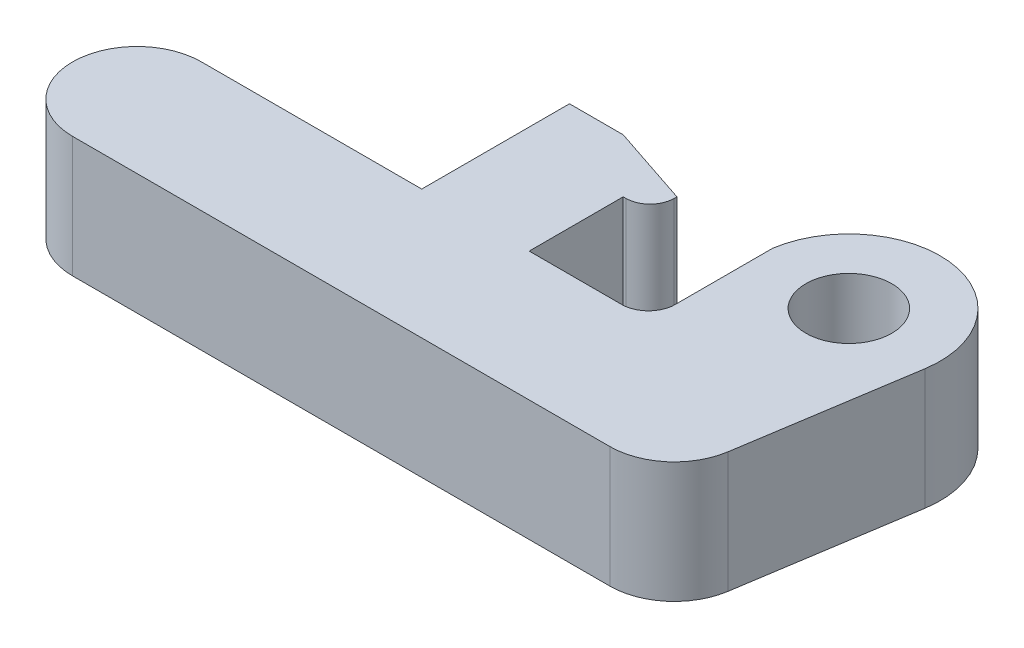
from build123d import *

# Parameters (mm, degrees)
SKETCH1_R           = 1.6
BOSS_EXTRUDE1_DEPTH = 4.5
CUT_EXTRUDE1_DEPTH  = 10
FILLET1_R           = 1


with BuildPart() as part:
    # Sketch1 → Boss-Extrude1 (new body)
    with BuildSketch(Plane(origin=(0, 0, 0), x_dir=(1, 0, 0), z_dir=(0, 1, 0))):
        with BuildLine():
            Line((3.359522367, -0.523076923), (2.371427553, -6.869230769))
            ThreePointArc((2.371427553, -6.869230769), (1.561064725, -8.322930861), (0, -8.9))
            Line((0, -8.9), (-20, -8.9))
            ThreePointArc((-20, -8.9), (-22.4, -6.5), (-20, -4.1))
            Line((-20, -4.1), (-11.8, -4.1))
            Line((-11.8, -4.1), (-11.8, 1.4))
            Line((-11.8, 1.4), (-9.8, 1.4))
            Line((-9.8, 1.4), (-6.8, 0.4))
            Line((-6.8, 0.4), (-6.8, 0.3))
            ThreePointArc((-6.8, 0.3), (-7.063603897, -0.336396103), (-7.7, -0.6))
            Line((-7.7, -0.6), (-7.8, -0.6))
            Line((-7.8, -0.6), (-7.8, -4.1))
            Line((-7.8, -4.1), (-4.079334467, -4.1))
            Line((-4.079334467, -4.1), (-3.359522367, 0.523076923))
            ThreePointArc((-3.359522367, 0.523076923), (0.523076923, 3.359522367), (3.359522367, -0.523076923))
        make_face()
        with Locations(Location((0, 0, 0), (0, 0, 270))):
            Circle(SKETCH1_R, mode=Mode.SUBTRACT)
    extrude(amount=BOSS_EXTRUDE1_DEPTH)

    # Sketch2 → Cut-Extrude1 (cut)
    with BuildSketch(Plane(origin=(0, 4.5, 0), x_dir=(1, 0, 0), z_dir=(0, 1, 0))):
        Polygon((-3.359522367, 0.523076923), (-3.359522367, -4.1), (-4.079334467, -4.1), align=None)
    extrude(amount=-CUT_EXTRUDE1_DEPTH, mode=Mode.SUBTRACT)

    # Fillet1
    fillet1_edges = [part.edges().sort_by_distance(p)[0] for p in [
        (-3.359522367, 2.25, 4.1),
    ]]
    fillet(fillet1_edges, radius=FILLET1_R)


solid = part.part
